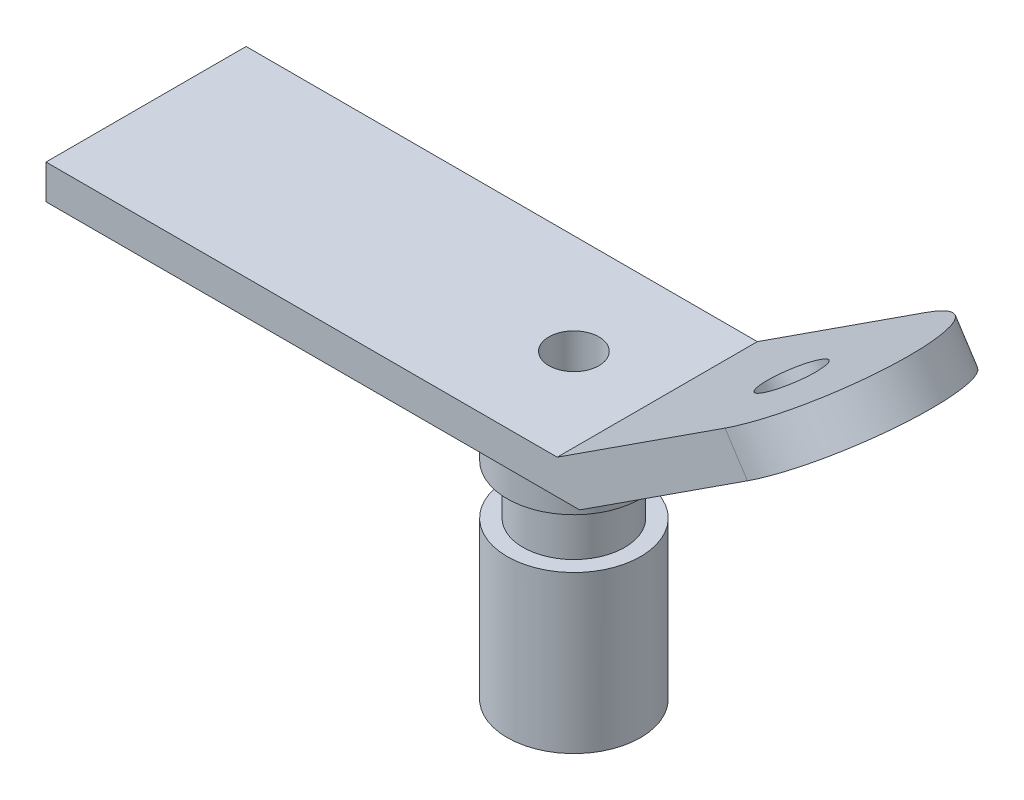
from build123d import *
from build123d.topology import SkipClean

# Parameters (mm, degrees)
BOSS_EXTRUDE1_DEPTH = 76.2
SKETCH2_R           = 25.4
SKETCH2_R_2         = 9.525
BOSS_EXTRUDE2_DEPTH = 101.6
SKETCH4_W           = 6.35
SKETCH4_H           = 19.05
SKETCH5_R           = 9.525
CUT_EXTRUDE1_DEPTH  = 240.623120754
SKETCH7_R           = 10.9982
CUT_EXTRUDE2_DEPTH  = 239.462040028
CUT_EXTRUDE3_DEPTH  = 239.462040028


with BuildPart() as part:
    # Sketch1 → Boss-Extrude1 (new body)
    with BuildSketch(Plane.XY):
        Polygon((-203.2, 13.126834176), (-8.532442214, 13.126834176), (0, 0), (-203.2, 0), align=None)
        Polygon((119.24636491, 96.183058807), (-8.532442214, 13.126834176), (0, 0), (127.778807124, 83.056224631), align=None)
    extrude(amount=BOSS_EXTRUDE1_DEPTH)

    # Sketch2 → Boss-Extrude2 (add)
    with BuildSketch(Plane.XZ):
        with Locations(Location((-40.282442214, 38.1, 0), (0, 0, 270))):
            Circle(SKETCH2_R)
        with Locations((-40.282442214, 38.1)):
            Circle(SKETCH2_R_2, mode=Mode.SUBTRACT)
    extrude(amount=BOSS_EXTRUDE2_DEPTH)

    # Sketch4 → Cut-Revolve1 (revolve, cut)
    with BuildSketch(Plane.XY.offset(38.1), mode=Mode.PRIVATE) as cut_revolve1_sk:
        with Locations((-62.817567444, -32.3596)):
            Rectangle(SKETCH4_W, SKETCH4_H)
    revolve(cut_revolve1_sk.sketch.rotate(Axis((-40.282442214, -101.6, 38.1), (0, 1, 0)), 270), axis=Axis((-40.282442214, -101.6, 38.1), (0, 1, 0)), mode=Mode.SUBTRACT)

    # Sketch5 → Cut-Extrude1 (cut, through all)
    with SkipClean():  # the faces are left unmerged after this step: merging them gives an invalid solid
        with BuildSketch(Plane.XZ):
            with Locations(Location((-40.282442214, 38.1, 0), (0, 0, 90))):
                Circle(SKETCH5_R)
        extrude(amount=-CUT_EXTRUDE1_DEPTH, mode=Mode.SUBTRACT)

    # Sketch7 → Cut-Extrude2 (cut, through all)
    with SkipClean():  # the faces are left unmerged after this step: merging them gives an invalid solid
        with BuildSketch(Plane(origin=(-8.532442214, 13.126834176, 0), x_dir=(0.8384436163006369, 0.5449883505954145, 0), z_dir=(-0.5449883505954145, 0.838443616300637, 0))):
            with Locations(Location((61.0108, -38.1, 0), (0, 0, 180))):
                Circle(SKETCH7_R)
        extrude(amount=-CUT_EXTRUDE2_DEPTH, mode=Mode.SUBTRACT)

    # Sketch8 → Cut-Extrude3 (cut, through all)
    with SkipClean():  # the faces are left unmerged after this step: merging them gives an invalid solid
        with BuildSketch(Plane(origin=(-8.532442214, 13.126834176, 0), x_dir=(0.8384436163006369, 0.5449883505954145, 0), z_dir=(-0.5449883505954145, 0.838443616300637, 0))):
            with BuildLine():
                Line((76.2, 0), (152.4, 0))
                Line((152.4, 0), (152.4, -76.2))
                Line((152.4, -76.2), (76.2, -76.2))
                ThreePointArc((76.2, -76.2), (114.3, -38.1), (76.2, 0))
            make_face()
        extrude(amount=-CUT_EXTRUDE3_DEPTH, mode=Mode.SUBTRACT)


solid = part.part
